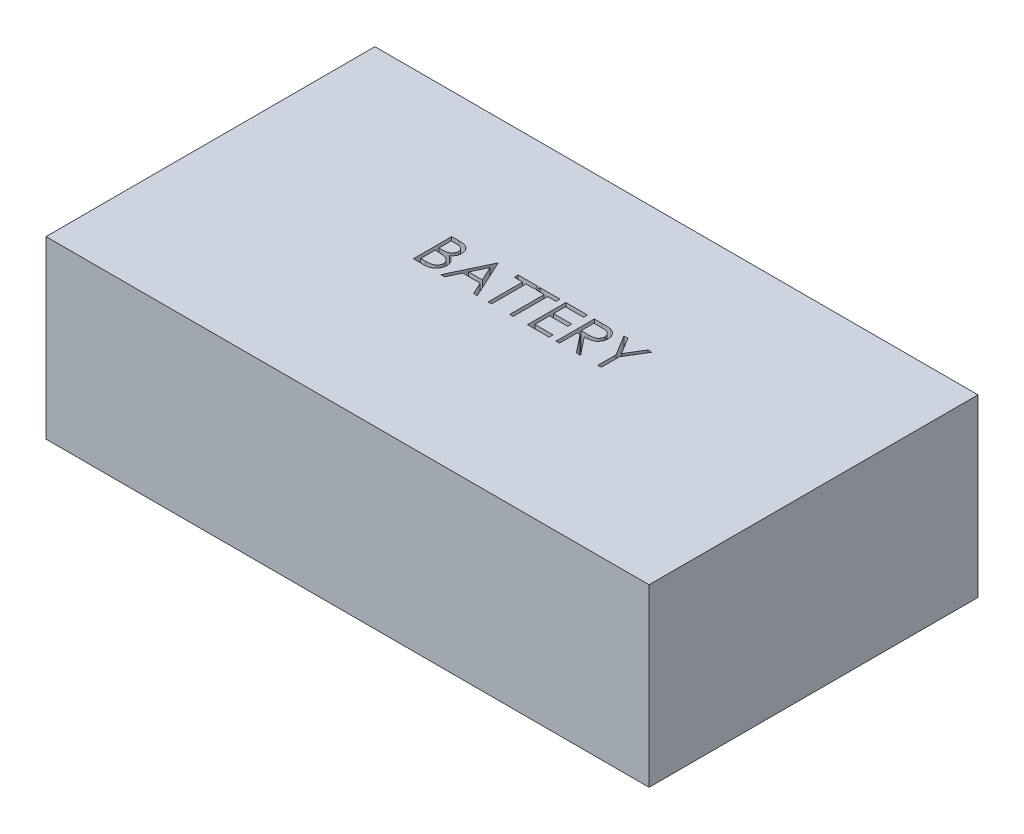
from build123d import *

# Parameters (mm, degrees)
SKETCH1_W           = 55
SKETCH1_H           = 30
BOSS_EXTRUDE1_DEPTH = 16
CUT_EXTRUDE1_DEPTH  = 2


with BuildPart() as part:
    # Sketch1 → Boss-Extrude1 (new body)
    with BuildSketch(Plane(origin=(0, 0, 0), x_dir=(1, 0, 0), z_dir=(0, 1, 0))):
        Rectangle(SKETCH1_W, SKETCH1_H)
    extrude(amount=BOSS_EXTRUDE1_DEPTH)

    # Sketch2 → Cut-Extrude1 (cut)
    # profile 1 of 7: a face of its own
    with BuildSketch(Plane(origin=(0, 16, 0), x_dir=(1, 0, 0), z_dir=(0, 1, 0))):
        with BuildLine():
            Line((-8.996794872, 3.5), (-8.313902244, 3.5))
            add(Edge.make_bspline(
                [(-8.313902244, 3.5), (-8.280473765, 3.49982425), (-8.215681055, 3.499483602), (-8.121461613, 3.49420047), (-8.033212803, 3.486996801), (-7.95090903, 3.475566708), (-7.874588328, 3.461774931), (-7.804020691, 3.445073115), (-7.739430518, 3.425046501), (-7.662317782, 3.39320022), (-7.574397121, 3.345877051), (-7.479198728, 3.275948486), (-7.397794489, 3.190416023), (-7.327608172, 3.093933368), (-7.271807052, 2.987797596), (-7.231437755, 2.874538407), (-7.205879879, 2.755616665), (-7.203251445, 2.673973487), (-7.201923077, 2.63271234)],
                knots=[0, 0, 0, 0, 1.001505555, 1.941167018, 2.826882275, 3.653841531, 4.429895133, 5.150066043, 5.825578002, 6.45369114, 7.647487171, 8.808567382, 9.977351308, 11.170798116, 12.373658725, 13.556498008, 14.765093433, 16, 16, 16, 16], degree=3))
            add(Edge.make_bspline(
                [(-7.201923077, 2.63271234), (-7.203016295, 2.594059784), (-7.205164573, 2.518103867), (-7.225707332, 2.407009758), (-7.257868, 2.301258539), (-7.30257325, 2.201236154), (-7.360675246, 2.10920254), (-7.429533565, 2.024415274), (-7.512610367, 1.950464217), (-7.574853607, 1.909121315), (-7.606470353, 1.888120994)],
                knots=[0, 0, 0, 0, 1.044552857, 2.05264487, 3.044412934, 4.028983338, 5.005914585, 5.980388656, 6.974128949, 8, 8, 8, 8], degree=3))
            add(Edge.make_bspline(
                [(-7.606470353, 1.888120994), (-7.566709925, 1.872855995), (-7.490638378, 1.84365027), (-7.385952365, 1.792014806), (-7.29575752, 1.735852696), (-7.219360374, 1.674520846), (-7.154022719, 1.608412035), (-7.096969778, 1.536556921), (-7.048288404, 1.458018163), (-7.00657548, 1.373614627), (-6.974026724, 1.284208159), (-6.94965082, 1.190637383), (-6.93568337, 1.093237828), (-6.933695729, 1.026952448), (-6.932692308, 0.993489583)],
                knots=[0, 0, 0, 0, 1.27268992, 2.434971085, 3.483601985, 4.442670788, 5.356604649, 6.2567628, 7.179492994, 8.113709626, 9.066344395, 10.018646069, 10.999752585, 12, 12, 12, 12], degree=3))
            add(Edge.make_bspline(
                [(-6.932692308, 0.993489583), (-6.933669154, 0.959322711), (-6.935591126, 0.892098433), (-6.949771097, 0.793343299), (-6.973780204, 0.698968352), (-7.006851351, 0.608363169), (-7.050013665, 0.521703035), (-7.10254163, 0.438889771), (-7.165173193, 0.36075544), (-7.235236062, 0.286431817), (-7.314498208, 0.21960403), (-7.400013963, 0.160088323), (-7.492860283, 0.111142261), (-7.591512277, 0.070026239), (-7.697076593, 0.038619041), (-7.8090792, 0.016646467), (-7.927423502, 0.00184143), (-8.008633253, 0.000624225), (-8.050280449, 0)],
                knots=[0, 0, 0, 0, 0.978564426, 1.925352924, 2.850884081, 3.763762016, 4.682927383, 5.618979971, 6.567305752, 7.547517671, 8.540179244, 9.531824382, 10.526200242, 11.540722885, 12.589160233, 13.674978461, 14.80764778, 16, 16, 16, 16], degree=3))
            Line((-8.050280449, 0), (-8.996794872, 0))
            Line((-8.996794872, 0), (-8.996794872, 3.5))
        make_face()
        with BuildLine():
            Line((-8.682692308, 3.141025641), (-8.682692308, 2.019230769))
            Line((-8.682692308, 2.019230769), (-8.471654647, 2.019230769))
            add(Edge.make_bspline(
                [(-8.471654647, 2.019230769), (-8.440805852, 2.019630692), (-8.381199693, 2.020403425), (-8.294879796, 2.022616942), (-8.214754778, 2.028814985), (-8.140962945, 2.035011248), (-8.073620501, 2.045085835), (-8.01287664, 2.057077958), (-7.957778043, 2.069760863), (-7.894238497, 2.09133035), (-7.822165549, 2.123208025), (-7.745332444, 2.172679861), (-7.677597975, 2.231604215), (-7.620400787, 2.299595176), (-7.573589317, 2.374461362), (-7.541075601, 2.455008243), (-7.519028317, 2.539228375), (-7.517036786, 2.597046627), (-7.516025641, 2.626402244)],
                knots=[0, 0, 0, 0, 1.156816544, 2.235205308, 3.236616184, 4.169592532, 5.011045266, 5.787822928, 6.49130361, 7.128639758, 8.301311294, 9.436451833, 10.541879658, 11.654887649, 12.756523258, 13.837046038, 14.901820046, 16, 16, 16, 16], degree=3))
            add(Edge.make_bspline(
                [(-7.516025641, 2.626402244), (-7.516551821, 2.645828015), (-7.517583981, 2.683933787), (-7.526037284, 2.739483141), (-7.540404858, 2.791726894), (-7.558859151, 2.841381004), (-7.58464784, 2.886892854), (-7.615011303, 2.92983605), (-7.651696994, 2.968748169), (-7.693454306, 3.005117667), (-7.741462929, 3.037362195), (-7.795694221, 3.065602958), (-7.856881898, 3.088343735), (-7.923994753, 3.108259887), (-7.998065841, 3.122248181), (-8.078240394, 3.133901569), (-8.165175113, 3.139834311), (-8.225320216, 3.140619673), (-8.256410256, 3.141025641)],
                knots=[0, 0, 0, 0, 0.91205012, 1.789085906, 2.630437955, 3.453916878, 4.269457761, 5.079663411, 5.91843418, 6.774407191, 7.675494373, 8.627863946, 9.638891023, 10.736472738, 11.911756761, 13.175263542, 14.539845004, 16, 16, 16, 16], degree=3))
            Line((-8.256410256, 3.141025641), (-8.682692308, 3.141025641))
        make_face(mode=Mode.SUBTRACT)
        with BuildLine():
            Line((-8.682692308, 1.66025641), (-8.682692308, 0.358974359))
            Line((-8.682692308, 0.358974359), (-8.235376603, 0.358974359))
            add(Edge.make_bspline(
                [(-8.235376603, 0.358974359), (-8.203357677, 0.359358106), (-8.141645418, 0.360097729), (-8.052544188, 0.362512283), (-7.969961084, 0.368004559), (-7.894272948, 0.376650409), (-7.824662496, 0.386028858), (-7.761964793, 0.398640139), (-7.705671599, 0.413089099), (-7.640397292, 0.435423272), (-7.566893783, 0.470119743), (-7.487682927, 0.522433969), (-7.417256709, 0.584757277), (-7.35745145, 0.656888191), (-7.308438461, 0.735319518), (-7.272783006, 0.818464868), (-7.250792149, 0.904950395), (-7.24812998, 0.963917108), (-7.246794872, 0.993489583)],
                knots=[0, 0, 0, 0, 1.160039823, 2.235823828, 3.228722157, 4.157150951, 4.99529583, 5.772374946, 6.472645482, 7.099169577, 8.269452708, 9.405989375, 10.527446681, 11.663510218, 12.788923519, 13.866172445, 14.929861265, 16, 16, 16, 16], degree=3))
            add(Edge.make_bspline(
                [(-7.246794872, 0.993489583), (-7.247070976, 1.011982924), (-7.247618731, 1.048671306), (-7.255879346, 1.102587125), (-7.267893216, 1.154812998), (-7.28342465, 1.205490739), (-7.306044117, 1.253704115), (-7.332450662, 1.300406674), (-7.363412064, 1.345660154), (-7.411656229, 1.402872407), (-7.481828214, 1.46878942), (-7.581534989, 1.533326923), (-7.694907287, 1.58537473), (-7.77713478, 1.607474206), (-7.819611378, 1.618890224)],
                knots=[0, 0, 0, 0, 0.723448775, 1.435228256, 2.130040452, 2.821711965, 3.505591119, 4.210454504, 4.921174351, 5.648778258, 7.137944449, 8.670945889, 10.280296675, 12, 12, 12, 12], degree=3))
            add(Edge.make_bspline(
                [(-7.819611378, 1.618890224), (-7.836640474, 1.622345308), (-7.873563066, 1.629836643), (-7.933770647, 1.637744346), (-8.002506516, 1.644789406), (-8.079929393, 1.650000564), (-8.166137234, 1.655387107), (-8.261314153, 1.657481929), (-8.365071467, 1.659981189), (-8.43706384, 1.660162323), (-8.474459135, 1.66025641)],
                knots=[0, 0, 0, 0, 0.634451884, 1.375622551, 2.216452059, 3.157844607, 4.20941857, 5.370758133, 6.634282058, 8, 8, 8, 8], degree=3))
            Line((-8.474459135, 1.66025641), (-8.682692308, 1.66025641))
        make_face(mode=Mode.SUBTRACT)
    # profile 2 of 7: a face of its own
    with BuildSketch(Plane(origin=(0, 16, 0), x_dir=(1, 0, 0), z_dir=(0, 1, 0))):
        Polygon((-4.778846154, 3.5), (-3.163461538, 0), (-3.504907853, 0), (-4.022335737, 1.121794872), (-5.608974359, 1.121794872), (-6.141125801, 0), (-6.483974359, 0), (-4.823717949, 3.5), align=None)
        Polygon((-4.80478766, 2.817808494), (-5.438601763, 1.480769231), (-4.187800481, 1.480769231), align=None, mode=Mode.SUBTRACT)
    # profile 3 of 7: a face of its own
    with BuildSketch(Plane(origin=(0, 16, 0), x_dir=(1, 0, 0), z_dir=(0, 1, 0))):
        Polygon((-2.939102564, 3.141025641), (-2.939102564, 3.5), (-1.099358974, 3.5), (-1.099358974, 3.141025641), (-1.862179487, 3.141025641), (-1.862179487, 0), (-2.176282051, 0), (-2.176282051, 3.141025641), align=None)
    # profile 4 of 7: a face of its own
    with BuildSketch(Plane(origin=(0, 16, 0), x_dir=(1, 0, 0), z_dir=(0, 1, 0))):
        Polygon((-0.96474359, 3.141025641), (-0.96474359, 3.5), (0.875, 3.5), (0.875, 3.141025641), (0.112179487, 3.141025641), (0.112179487, 0), (-0.201923077, 0), (-0.201923077, 3.141025641), align=None)
    # profile 5 of 7: a face of its own
    with BuildSketch(Plane(origin=(0, 16, 0), x_dir=(1, 0, 0), z_dir=(0, 1, 0))):
        Polygon((1.413461538, 3.5), (3.387820513, 3.5), (3.387820513, 3.141025641), (1.727564103, 3.141025641), (1.727564103, 2.064102564), (3.387820513, 2.064102564), (3.387820513, 1.705128205), (1.727564103, 1.705128205), (1.727564103, 0.358974359), (3.387820513, 0.358974359), (3.387820513, 0), (1.413461538, 0), align=None)
    # profile 6 of 7: a face of its own
    with BuildSketch(Plane(origin=(0, 16, 0), x_dir=(1, 0, 0), z_dir=(0, 1, 0))):
        with BuildLine():
            Line((4.016025641, 3.5), (4.716446314, 3.5))
            add(Edge.make_bspline(
                [(4.716446314, 3.5), (4.763187443, 3.499844414), (4.852935587, 3.499545672), (4.981508857, 3.497879909), (5.098335954, 3.493105553), (5.203355794, 3.48899697), (5.296566449, 3.481505028), (5.378253739, 3.474344381), (5.448041437, 3.46497072), (5.490287288, 3.456265297), (5.509415064, 3.452323718)],
                knots=[0, 0, 0, 0, 1.410062039, 2.707475311, 3.878576406, 4.937260626, 5.877586885, 6.699081471, 7.410979367, 8, 8, 8, 8], degree=3))
            add(Edge.make_bspline(
                [(5.509415064, 3.452323718), (5.535021688, 3.445996953), (5.585688678, 3.433478389), (5.658638744, 3.407018788), (5.728153068, 3.376399163), (5.793942892, 3.340435443), (5.855678683, 3.298860663), (5.913996994, 3.252392541), (5.969162457, 3.201285335), (6.018944088, 3.144250494), (6.065883139, 3.084413984), (6.105471766, 3.019710227), (6.139598245, 2.9520487), (6.166768762, 2.880741282), (6.188646736, 2.80647951), (6.204072975, 2.728590713), (6.213324163, 2.647429738), (6.214266019, 2.59207183), (6.21474359, 2.564002404)],
                knots=[0, 0, 0, 0, 1.027469482, 2.033020251, 3.019912614, 3.986113645, 4.951240523, 5.91722682, 6.890402269, 7.87763091, 8.8651537, 9.85103654, 10.82876324, 11.815024772, 12.821070561, 13.842952187, 14.906261191, 16, 16, 16, 16], degree=3))
            add(Edge.make_bspline(
                [(6.21474359, 2.564002404), (6.213274592, 2.517367299), (6.210408196, 2.426370131), (6.183683092, 2.29430925), (6.139906572, 2.171119935), (6.079583283, 2.056957297), (6.002763808, 1.954046652), (5.910439017, 1.863656197), (5.802557405, 1.788016284), (5.702128089, 1.735563479), (5.613413889, 1.701970571), (5.540380577, 1.678334212), (5.460713599, 1.660072247), (5.375176265, 1.643712115), (5.283412609, 1.63136042), (5.18564257, 1.622313826), (5.081796418, 1.616659777), (5.010457349, 1.615817772), (4.973758013, 1.615384615)],
                knots=[0, 0, 0, 0, 1.260483769, 2.459530307, 3.627416485, 4.787058657, 5.939039949, 7.08810263, 8.267026773, 9.491475466, 10.141966685, 10.831826277, 11.566392101, 12.351337768, 13.187381173, 14.07005841, 15.007169909, 16, 16, 16, 16], degree=3))
            Line((4.973758013, 1.615384615), (6.259615385, 0))
            Line((6.259615385, 0), (5.87119391, 0))
            Line((5.87119391, 0), (4.585336538, 1.615384615))
            Line((4.585336538, 1.615384615), (4.330128205, 1.615384615))
            Line((4.330128205, 1.615384615), (4.330128205, 0))
            Line((4.330128205, 0), (4.016025641, 0))
            Line((4.016025641, 0), (4.016025641, 3.5))
        make_face()
        with BuildLine():
            Line((4.330128205, 3.141025641), (4.330128205, 1.974358974))
            Line((4.330128205, 1.974358974), (4.970953526, 1.969451122))
            add(Edge.make_bspline(
                [(4.970953526, 1.969451122), (5.000873565, 1.969437885), (5.058867122, 1.969412229), (5.142767786, 1.973406005), (5.220887898, 1.977949323), (5.29292865, 1.984898669), (5.358922226, 1.99385474), (5.418835639, 2.005057725), (5.472766691, 2.018109787), (5.535665229, 2.038311413), (5.605901761, 2.070317431), (5.68223322, 2.11688293), (5.747235558, 2.175452049), (5.802153421, 2.242425505), (5.846282852, 2.316061754), (5.877394906, 2.395478123), (5.897137349, 2.478669721), (5.899465894, 2.535847829), (5.900641026, 2.564703526)],
                knots=[0, 0, 0, 0, 1.146690395, 2.22261258, 3.21895312, 4.145990853, 4.996080663, 5.770904154, 6.481378293, 7.121626537, 8.300444488, 9.431385265, 10.535395872, 11.636531494, 12.74115979, 13.810798291, 14.895190096, 16, 16, 16, 16], degree=3))
            add(Edge.make_bspline(
                [(5.900641026, 2.564703526), (5.899438905, 2.592850099), (5.897056739, 2.648626338), (5.877607971, 2.730282248), (5.844718589, 2.807349198), (5.800396351, 2.879513683), (5.746397196, 2.945019419), (5.683079384, 3.001066572), (5.612174189, 3.047316037), (5.54590299, 3.076870418), (5.486668778, 3.094990271), (5.435239118, 3.107741435), (5.37712764, 3.117985904), (5.312052181, 3.126193964), (5.240290551, 3.133248909), (5.161479899, 3.138000687), (5.076143119, 3.140814551), (5.016996188, 3.14095364), (4.986378205, 3.141025641)],
                knots=[0, 0, 0, 0, 1.101028733, 2.181837193, 3.264309656, 4.369019818, 5.486613113, 6.575447106, 7.666700264, 8.788928104, 9.402425223, 10.0903467, 10.862060571, 11.710948788, 12.657782767, 13.684531032, 14.801375019, 16, 16, 16, 16], degree=3))
            Line((4.986378205, 3.141025641), (4.330128205, 3.141025641))
        make_face(mode=Mode.SUBTRACT)
    # profile 7 of 7: a face of its own
    with BuildSketch(Plane(origin=(0, 16, 0), x_dir=(1, 0, 0), z_dir=(0, 1, 0))):
        Polygon((6.708333333, 3.5), (7.068008814, 3.5), (7.987880609, 1.99609375), (8.90635016, 3.5), (9.266025641, 3.5), (8.144230769, 1.663762019), (8.144230769, 0), (7.830128205, 0), (7.830128205, 1.663762019), align=None)
    extrude(amount=-CUT_EXTRUDE1_DEPTH, mode=Mode.SUBTRACT)


solid = part.part
